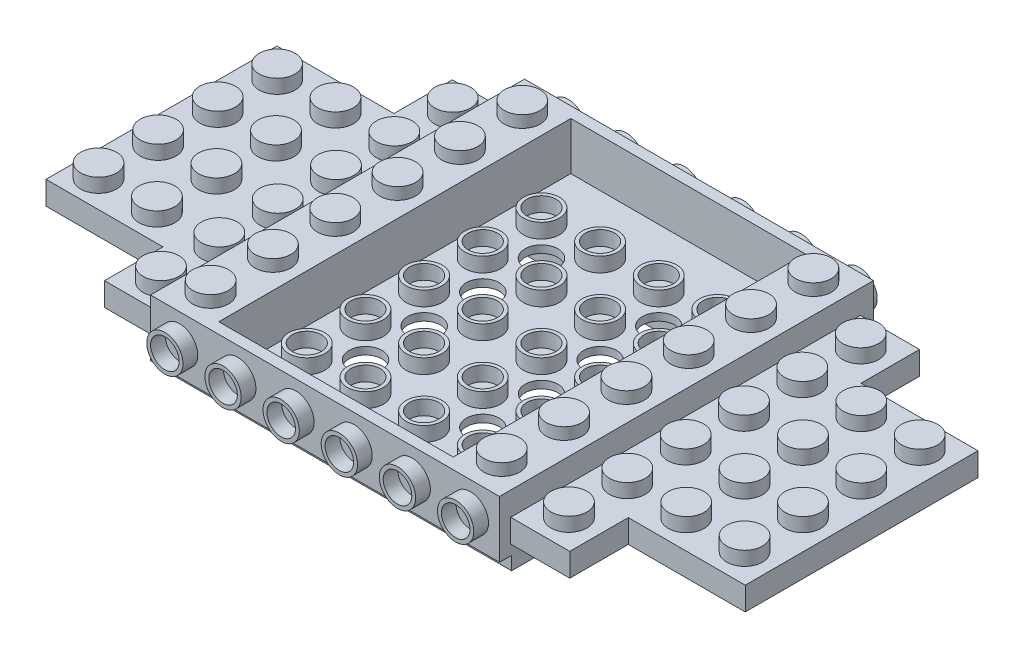
from build123d import *

# Parameters (mm, degrees)
SKETCH2_W            = 47.72
SKETCH2_H            = 51.14
BOSS_EXTRUDE1_DEPTH  = 9.64
SKETCH3_W            = 32.06
SKETCH3_H            = 48.14
CUT_EXTRUDE1_DEPTH   = 6.53
SKETCH4_W            = 47.83
SKETCH4_H            = 3.18
BOSS_EXTRUDE2_DEPTH  = 8.08
SKETCH5_W            = 1.66
SKETCH5_H            = 1.84
CUT_EXTRUDE2_DEPTH   = 55.990480085
SKETCH6_W            = 31.83
SKETCH6_H            = 3.18
BOSS_EXTRUDE3_DEPTH  = 16
SKETCH8_W            = 47.58
SKETCH8_H            = 3.18
BOSS_EXTRUDE4_DEPTH  = 8.08
SKETCH9_W            = 31.58
SKETCH9_H            = 3.18
BOSS_EXTRUDE5_DEPTH  = 16
SKETCH12_R           = 2.455
BOSS_EXTRUDE6_DEPTH  = 1.91
SKETCH13_R           = 2.455
BOSS_EXTRUDE7_DEPTH  = 1.91
SKETCH14_W           = 22.48
SKETCH14_H           = 28.38
CUT_EXTRUDE3_DEPTH   = 2.25
SKETCH17_W           = 6.48
SKETCH17_H           = 6.4
CUT_EXTRUDE7_DEPTH   = 2.25
SKETCH18_W           = 22.48
SKETCH18_H           = 28.63
SKETCH18_W_2         = 6.48
SKETCH18_H_2         = 6.4
CUT_EXTRUDE8_DEPTH   = 2.25
SKETCH20_R           = 0.855
CUT_EXTRUDE9_DEPTH   = 1.64
SKETCH21_R           = 0.855
CUT_EXTRUDE10_DEPTH  = 1.64
SKETCH22_R           = 2.48
SKETCH22_R_2         = 1.955
BOSS_EXTRUDE8_DEPTH  = 2.02
BOSS_EXTRUDE9_START  = 2.02
SKETCH23_R           = 2.48
SKETCH23_R_2         = 1.955
BOSS_EXTRUDE9_DEPTH  = 2.02
SKETCH24_R           = 2.455
BOSS_EXTRUDE10_DEPTH = 1.62
SKETCH25_W           = 45.2
SKETCH25_H           = 6.466900246
SKETCH25_W_2         = 5.18
SKETCH25_H_2         = 28.906199508
SKETCH25_W_3         = 5.24
SKETCH25_W_4         = 31.96
CUT_EXTRUDE11_DEPTH  = 2.09
SKETCH26_R           = 2.465
SKETCH26_R_2         = 1.995
BOSS_EXTRUDE11_DEPTH = 1.99
SKETCH27_R           = 2.25
CUT_EXTRUDE14_DEPTH  = 56.909517973
SKETCH28_W           = 5.18
SKETCH28_H           = 28.906199508
CUT_EXTRUDE15_DEPTH  = 6.2
SKETCH30_W           = 5.24
SKETCH30_H           = 28.906199508
CUT_EXTRUDE16_DEPTH  = 6.2
SKETCH31_W           = 5.24
SKETCH31_H           = 6.466900246
SKETCH31_W_2         = 5.18
CUT_EXTRUDE17_DEPTH  = 6.2
SKETCH32_W           = 5.24
SKETCH32_H           = 6.466900246
SKETCH32_W_2         = 5.18
CUT_EXTRUDE18_DEPTH  = 6.2
FILLET1_R            = 0.4
SKETCH34_R           = 1.485
SKETCH34_R_2         = 1.035
BOSS_EXTRUDE13_DEPTH = 2.3
SKETCH35_R           = 3.23
SKETCH35_R_2         = 2.43
BOSS_EXTRUDE15_DEPTH = 2.05


with BuildPart() as part:
    # Sketch2 → Boss-Extrude1 (new body)
    with BuildSketch(Plane(origin=(0, 0, 0), x_dir=(1, 0, 0), z_dir=(0, 1, 0))):
        Rectangle(SKETCH2_W, SKETCH2_H)
    extrude(amount=-BOSS_EXTRUDE1_DEPTH)

    # Sketch3 → Cut-Extrude1 (cut)
    with BuildSketch(Plane(origin=(0, 0, 0), x_dir=(1, 0, 0), z_dir=(0, 1, 0))):
        Rectangle(SKETCH3_W, SKETCH3_H)
    extrude(amount=-CUT_EXTRUDE1_DEPTH, mode=Mode.SUBTRACT)

    # Sketch4 → Boss-Extrude2 (add)
    with BuildSketch(Plane(origin=(23.86, 0, 0), x_dir=(0, 0, -1), z_dir=(1, 0, 0))):
        with Locations((-0.125, -4.82)):
            Rectangle(SKETCH4_W, SKETCH4_H)
    extrude(amount=BOSS_EXTRUDE2_DEPTH)

    # Sketch5 → Cut-Extrude2 (cut, through all)
    with BuildSketch(Plane(origin=(23.86, 0, 0), x_dir=(0, 0, -1), z_dir=(1, 0, 0))):
        with Locations((-24.74, -8.72)):
            Rectangle(SKETCH5_W, SKETCH5_H)
        with Locations((24.74, -8.72)):
            Rectangle(SKETCH5_W, SKETCH5_H)
    extrude(amount=-CUT_EXTRUDE2_DEPTH, mode=Mode.SUBTRACT)

    # Sketch6 → Boss-Extrude3 (add)
    with BuildSketch(Plane(origin=(31.94, 0, 0), x_dir=(0, 0, -1), z_dir=(1, 0, 0))):
        with Locations((-0.125, -4.82)):
            Rectangle(SKETCH6_W, SKETCH6_H)
    extrude(amount=BOSS_EXTRUDE3_DEPTH)

    # Sketch8 → Boss-Extrude4 (add)
    with BuildSketch(Plane.ZY.offset(23.86)):
        with Locations((0, -4.82)):
            Rectangle(SKETCH8_W, SKETCH8_H)
    extrude(amount=BOSS_EXTRUDE4_DEPTH)

    # Sketch9 → Boss-Extrude5 (add)
    with BuildSketch(Plane.ZY.offset(31.94)):
        with Locations((0, -4.82)):
            Rectangle(SKETCH9_W, SKETCH9_H)
    extrude(amount=BOSS_EXTRUDE5_DEPTH)

    # Sketch12 → Boss-Extrude6 (add)
    with BuildSketch(Plane(origin=(0, -3.23, 0), x_dir=(1, 0, 0), z_dir=(0, 1, 0))):
        with Locations(Location((-27.9, 19.79, 0), (0, 0, 90))):
            Circle(SKETCH12_R)
        with Locations(Location((-27.9, 11.811666667, 0), (0, 0, 90))):
            Circle(SKETCH12_R)
        with Locations(Location((-27.9, 3.833333333, 0), (0, 0, 90))):
            Circle(SKETCH12_R)
        with Locations(Location((-27.9, -4.145, 0), (0, 0, 90))):
            Circle(SKETCH12_R)
        with Locations(Location((-27.9, -12.123333333, 0), (0, 0, 90))):
            Circle(SKETCH12_R)
        with Locations(Location((-27.9, -20.101666667, 0), (0, 0, 90))):
            Circle(SKETCH12_R)
        with Locations(Location((-43.9275, 11.811666667, 0), (0, 0, 90))):
            Circle(SKETCH12_R)
        with Locations(Location((-35.9475, 11.811666667, 0), (0, 0, 90))):
            Circle(SKETCH12_R)
        with Locations(Location((-36.110586548, 3.833333333, 0), (0, 0, 90))):
            Circle(SKETCH12_R)
        with Locations(Location((-36.273673097, -4.145, 0), (0, 0, 90))):
            Circle(SKETCH12_R)
        with Locations(Location((-36.436759645, -12.123333333, 0), (0, 0, 90))):
            Circle(SKETCH12_R)
        with Locations(Location((-44.090586548, 3.833333333, 0), (0, 0, 90))):
            Circle(SKETCH12_R)
        with Locations(Location((-44.253673097, -4.145, 0), (0, 0, 90))):
            Circle(SKETCH12_R)
        with Locations(Location((-44.416759645, -12.123333333, 0), (0, 0, 90))):
            Circle(SKETCH12_R)
    extrude(amount=BOSS_EXTRUDE6_DEPTH)

    # Sketch13 → Boss-Extrude7 (add)
    with BuildSketch(Plane(origin=(0, -3.23, 0), x_dir=(1, 0, 0), z_dir=(0, 1, 0))):
        with Locations(Location((27.9, 19.79, 0), (0, 0, 90))):
            Circle(SKETCH13_R)
        with Locations(Location((27.9, 11.81, 0), (0, 0, 90))):
            Circle(SKETCH13_R)
        with Locations(Location((27.9, 3.83, 0), (0, 0, 90))):
            Circle(SKETCH13_R)
        with Locations(Location((27.9, -4.15, 0), (0, 0, 90))):
            Circle(SKETCH13_R)
        with Locations(Location((27.9, -12.13, 0), (0, 0, 90))):
            Circle(SKETCH13_R)
        with Locations(Location((27.9, -20.11, 0), (0, 0, 90))):
            Circle(SKETCH13_R)
        with Locations(Location((43.94, 11.81, 0), (0, 0, 90))):
            Circle(SKETCH13_R)
        with Locations(Location((35.96, 11.81, 0), (0, 0, 90))):
            Circle(SKETCH13_R)
        with Locations(Location((35.96, 3.83, 0), (0, 0, 90))):
            Circle(SKETCH13_R)
        with Locations(Location((35.96, -4.15, 0), (0, 0, 90))):
            Circle(SKETCH13_R)
        with Locations(Location((35.96, -12.13, 0), (0, 0, 90))):
            Circle(SKETCH13_R)
        with Locations(Location((43.94, 3.83, 0), (0, 0, 90))):
            Circle(SKETCH13_R)
        with Locations(Location((43.94, -4.15, 0), (0, 0, 90))):
            Circle(SKETCH13_R)
        with Locations(Location((43.94, -12.13, 0), (0, 0, 90))):
            Circle(SKETCH13_R)
    extrude(amount=BOSS_EXTRUDE7_DEPTH)

    # Sketch14 → Cut-Extrude3 (cut)
    with BuildSketch(Plane.XZ.offset(6.41)):
        with Locations((-35.1, 0)):
            Rectangle(SKETCH14_W, SKETCH14_H)
    extrude(amount=-CUT_EXTRUDE3_DEPTH, mode=Mode.SUBTRACT)

    # Sketch17 → Cut-Extrude7 (cut)
    with BuildSketch(Plane.XZ.offset(6.41)):
        with Locations((-27.1, 18.99)):
            Rectangle(SKETCH17_W, SKETCH17_H)
        with Locations((-27.1, -18.99)):
            Rectangle(SKETCH17_W, SKETCH17_H)
    extrude(amount=-CUT_EXTRUDE7_DEPTH, mode=Mode.SUBTRACT)

    # Sketch18 → Cut-Extrude8 (cut)
    with BuildSketch(Plane.XZ.offset(6.41)):
        with Locations((35.1, 0.125)):
            Rectangle(SKETCH18_W, SKETCH18_H)
        with Locations((27.1, 19.24)):
            Rectangle(SKETCH18_W_2, SKETCH18_H_2)
        with Locations((27.1, -19.24)):
            Rectangle(SKETCH18_W_2, SKETCH18_H_2)
    extrude(amount=-CUT_EXTRUDE8_DEPTH, mode=Mode.SUBTRACT)

    # Sketch20 → Cut-Extrude9 (cut)
    with BuildSketch(Plane.XZ.offset(4.16)):
        with Locations(Location((27.9, 20.04, 0), (0, 0, 270))):
            Circle(SKETCH20_R)
        with Locations(Location((27.9, 12.06, 0), (0, 0, 270))):
            Circle(SKETCH20_R)
        with Locations(Location((27.9, 4.08, 0), (0, 0, 270))):
            Circle(SKETCH20_R)
        with Locations(Location((27.9, -3.9, 0), (0, 0, 270))):
            Circle(SKETCH20_R)
        with Locations(Location((27.9, -11.88, 0), (0, 0, 270))):
            Circle(SKETCH20_R)
        with Locations(Location((27.9, -19.86, 0), (0, 0, 270))):
            Circle(SKETCH20_R)
        with Locations(Location((35.88, -11.88, 0), (0, 0, 270))):
            Circle(SKETCH20_R)
        with Locations(Location((35.88, -3.9, 0), (0, 0, 270))):
            Circle(SKETCH20_R)
        with Locations(Location((43.86, -11.88, 0), (0, 0, 270))):
            Circle(SKETCH20_R)
        with Locations(Location((43.86, -3.9, 0), (0, 0, 270))):
            Circle(SKETCH20_R)
        with Locations(Location((35.88, 4.08, 0), (0, 0, 270))):
            Circle(SKETCH20_R)
        with Locations(Location((35.88, 12.06, 0), (0, 0, 270))):
            Circle(SKETCH20_R)
        with Locations(Location((43.86, 4.08, 0), (0, 0, 270))):
            Circle(SKETCH20_R)
        with Locations(Location((43.86, 12.06, 0), (0, 0, 270))):
            Circle(SKETCH20_R)
    extrude(amount=-CUT_EXTRUDE9_DEPTH, mode=Mode.SUBTRACT)

    # Sketch21 → Cut-Extrude10 (cut)
    with BuildSketch(Plane.XZ.offset(4.16)):
        with Locations(Location((-27.9, -19.79, 0), (0, 0, 270))):
            Circle(SKETCH21_R)
        with Locations(Location((-27.9, -11.81, 0), (0, 0, 270))):
            Circle(SKETCH21_R)
        with Locations(Location((-27.9, -3.83, 0), (0, 0, 270))):
            Circle(SKETCH21_R)
        with Locations(Location((-27.9, 4.15, 0), (0, 0, 270))):
            Circle(SKETCH21_R)
        with Locations(Location((-27.9, 12.13, 0), (0, 0, 270))):
            Circle(SKETCH21_R)
        with Locations(Location((-27.9, 20.11, 0), (0, 0, 270))):
            Circle(SKETCH21_R)
        with Locations(Location((-43.9275, -11.811666667, 0), (0, 0, 270))):
            Circle(SKETCH21_R)
        with Locations(Location((-43.9275, -3.831666667, 0), (0, 0, 270))):
            Circle(SKETCH21_R)
        with Locations(Location((-43.9275, 4.148333333, 0), (0, 0, 270))):
            Circle(SKETCH21_R)
        with Locations(Location((-43.9275, 12.128333333, 0), (0, 0, 270))):
            Circle(SKETCH21_R)
        with Locations(Location((-35.9475, -3.831666667, 0), (0, 0, 270))):
            Circle(SKETCH21_R)
        with Locations(Location((-35.9475, 4.148333333, 0), (0, 0, 270))):
            Circle(SKETCH21_R)
        with Locations(Location((-35.9475, 12.128333333, 0), (0, 0, 270))):
            Circle(SKETCH21_R)
        with Locations(Location((-35.9475, -11.811666667, 0), (0, 0, 270))):
            Circle(SKETCH21_R)
    extrude(amount=-CUT_EXTRUDE10_DEPTH, mode=Mode.SUBTRACT)

    # Sketch22 → Boss-Extrude8 (add)
    # profile 1 of 6: a face of its own
    with BuildSketch(Plane(origin=(0, 0, -25.57), x_dir=(-1, 0, 0), z_dir=(0, 0, -1))):
        with Locations((-19.883333333, -3.9)):
            Circle(SKETCH22_R)
        with Locations((-19.883333333, -3.9)):
            Circle(SKETCH22_R_2, mode=Mode.SUBTRACT)
    # profile 2 of 6: a face of its own
    with BuildSketch(Plane(origin=(0, 0, -25.57), x_dir=(-1, 0, 0), z_dir=(0, 0, -1))):
        with Locations((-11.93, -3.9)):
            Circle(SKETCH22_R)
        with Locations((-11.93, -3.9)):
            Circle(SKETCH22_R_2, mode=Mode.SUBTRACT)
    # profile 3 of 6: a face of its own
    with BuildSketch(Plane(origin=(0, 0, -25.57), x_dir=(-1, 0, 0), z_dir=(0, 0, -1))):
        with Locations((-3.976666667, -3.9)):
            Circle(SKETCH22_R)
        with Locations((-3.976666667, -3.9)):
            Circle(SKETCH22_R_2, mode=Mode.SUBTRACT)
    # profile 4 of 6: a face of its own
    with BuildSketch(Plane(origin=(0, 0, -25.57), x_dir=(-1, 0, 0), z_dir=(0, 0, -1))):
        with Locations((3.976666667, -3.9)):
            Circle(SKETCH22_R)
        with Locations((3.976666667, -3.9)):
            Circle(SKETCH22_R_2, mode=Mode.SUBTRACT)
    # profile 5 of 6: a face of its own
    with BuildSketch(Plane(origin=(0, 0, -25.57), x_dir=(-1, 0, 0), z_dir=(0, 0, -1))):
        with Locations((11.93, -3.9)):
            Circle(SKETCH22_R)
        with Locations((11.93, -3.9)):
            Circle(SKETCH22_R_2, mode=Mode.SUBTRACT)
    # profile 6 of 6: a face of its own
    with BuildSketch(Plane(origin=(0, 0, -25.57), x_dir=(-1, 0, 0), z_dir=(0, 0, -1))):
        with Locations((19.883333333, -3.9)):
            Circle(SKETCH22_R)
        with Locations((19.883333333, -3.9)):
            Circle(SKETCH22_R_2, mode=Mode.SUBTRACT)
    extrude(amount=BOSS_EXTRUDE8_DEPTH)

    # Sketch23 → Boss-Extrude9 (add)
    # profile 1 of 6: a face of its own
    with BuildSketch(Plane.XY.offset(25.57).offset(BOSS_EXTRUDE9_START)):
        with Locations(Location((-19.883333333, -3.9, 0), (0, 0, 180))):
            Circle(SKETCH23_R)
        with Locations(Location((-19.883333333, -3.9, 0), (0, 0, 180))):
            Circle(SKETCH23_R_2, mode=Mode.SUBTRACT)
    # profile 2 of 6: a face of its own
    with BuildSketch(Plane.XY.offset(25.57).offset(BOSS_EXTRUDE9_START)):
        with Locations(Location((-11.93, -3.9, 0), (0, 0, 180))):
            Circle(SKETCH23_R)
        with Locations(Location((-11.93, -3.9, 0), (0, 0, 180))):
            Circle(SKETCH23_R_2, mode=Mode.SUBTRACT)
    # profile 3 of 6: a face of its own
    with BuildSketch(Plane.XY.offset(25.57).offset(BOSS_EXTRUDE9_START)):
        with Locations(Location((-3.976666667, -3.9, 0), (0, 0, 180))):
            Circle(SKETCH23_R)
        with Locations(Location((-3.976666667, -3.9, 0), (0, 0, 180))):
            Circle(SKETCH23_R_2, mode=Mode.SUBTRACT)
    # profile 4 of 6: a face of its own
    with BuildSketch(Plane.XY.offset(25.57).offset(BOSS_EXTRUDE9_START)):
        with Locations(Location((3.976666667, -3.9, 0), (0, 0, 180))):
            Circle(SKETCH23_R)
        with Locations(Location((3.976666667, -3.9, 0), (0, 0, 180))):
            Circle(SKETCH23_R_2, mode=Mode.SUBTRACT)
    # profile 5 of 6: a face of its own
    with BuildSketch(Plane.XY.offset(25.57).offset(BOSS_EXTRUDE9_START)):
        with Locations(Location((11.93, -3.9, 0), (0, 0, 180))):
            Circle(SKETCH23_R)
        with Locations(Location((11.93, -3.9, 0), (0, 0, 180))):
            Circle(SKETCH23_R_2, mode=Mode.SUBTRACT)
    # profile 6 of 6: a face of its own
    with BuildSketch(Plane.XY.offset(25.57).offset(BOSS_EXTRUDE9_START)):
        with Locations(Location((19.883333333, -3.9, 0), (0, 0, 180))):
            Circle(SKETCH23_R)
        with Locations(Location((19.883333333, -3.9, 0), (0, 0, 180))):
            Circle(SKETCH23_R_2, mode=Mode.SUBTRACT)
    extrude(amount=-BOSS_EXTRUDE9_DEPTH)

    # Sketch24 → Boss-Extrude10 (add)
    with BuildSketch(Plane(origin=(0, 0, 0), x_dir=(1, 0, 0), z_dir=(0, 1, 0))):
        with Locations(Location((-19.91, 21.308333333, 0), (0, 0, 270))):
            Circle(SKETCH24_R)
        with Locations(Location((-19.91, 12.785, 0), (0, 0, 270))):
            Circle(SKETCH24_R)
        with Locations(Location((-19.91, 4.261666667, 0), (0, 0, 270))):
            Circle(SKETCH24_R)
        with Locations(Location((-19.91, -4.261666667, 0), (0, 0, 270))):
            Circle(SKETCH24_R)
        with Locations(Location((-19.91, -12.785, 0), (0, 0, 270))):
            Circle(SKETCH24_R)
        with Locations(Location((-19.91, -21.308333333, 0), (0, 0, 270))):
            Circle(SKETCH24_R)
        with Locations(Location((19.91, -21.308333333, 0), (0, 0, 90))):
            Circle(SKETCH24_R)
        with Locations(Location((19.91, -12.785, 0), (0, 0, 90))):
            Circle(SKETCH24_R)
        with Locations(Location((19.91, -4.261666667, 0), (0, 0, 90))):
            Circle(SKETCH24_R)
        with Locations(Location((19.91, 4.261666667, 0), (0, 0, 90))):
            Circle(SKETCH24_R)
        with Locations(Location((19.91, 12.785, 0), (0, 0, 90))):
            Circle(SKETCH24_R)
        with Locations(Location((19.91, 21.308333333, 0), (0, 0, 90))):
            Circle(SKETCH24_R)
    extrude(amount=BOSS_EXTRUDE10_DEPTH)

    # Sketch25 → Cut-Extrude11 (cut)
    with BuildSketch(Plane.XZ.offset(9.64)):
        with Locations((0, 19.126549877)):
            Rectangle(SKETCH25_W, SKETCH25_H)
        with Locations((20.01, 0)):
            Rectangle(SKETCH25_W_2, SKETCH25_H_2)
        with Locations((-19.98, 0)):
            Rectangle(SKETCH25_W_3, SKETCH25_H_2)
        with Locations((0, -19.126549877)):
            Rectangle(SKETCH25_W, SKETCH25_H)
        Rectangle(SKETCH25_W_4, SKETCH25_H_2)
    extrude(amount=-CUT_EXTRUDE11_DEPTH, mode=Mode.SUBTRACT)

    # Sketch26 → Boss-Extrude11 (add)
    # profile 1 of 20: a face of its own
    with BuildSketch(Plane(origin=(0, -6.53, 0), x_dir=(1, 0, 0), z_dir=(0, 1, 0))):
        with Locations(Location((-12.0225, 16.046666667, 0), (0, 0, 270))):
            Circle(SKETCH26_R)
        with Locations(Location((-12.0225, 16.046666667, 0), (0, 0, 270))):
            Circle(SKETCH26_R_2, mode=Mode.SUBTRACT)
    # profile 2 of 20: a face of its own
    with BuildSketch(Plane(origin=(0, -6.53, 0), x_dir=(1, 0, 0), z_dir=(0, 1, 0))):
        with Locations(Location((-3.999166667, 16.046666667, 0), (0, 0, 270))):
            Circle(SKETCH26_R)
        with Locations(Location((-3.999166667, 16.046666667, 0), (0, 0, 270))):
            Circle(SKETCH26_R_2, mode=Mode.SUBTRACT)
    # profile 3 of 20: a face of its own
    with BuildSketch(Plane(origin=(0, -6.53, 0), x_dir=(1, 0, 0), z_dir=(0, 1, 0))):
        with Locations(Location((4.024166667, 16.046666667, 0), (0, 0, 270))):
            Circle(SKETCH26_R)
        with Locations(Location((4.024166667, 16.046666667, 0), (0, 0, 270))):
            Circle(SKETCH26_R_2, mode=Mode.SUBTRACT)
    # profile 4 of 20: a face of its own
    with BuildSketch(Plane(origin=(0, -6.53, 0), x_dir=(1, 0, 0), z_dir=(0, 1, 0))):
        with Locations(Location((12.0475, 16.046666667, 0), (0, 0, 270))):
            Circle(SKETCH26_R)
        with Locations(Location((12.0475, 16.046666667, 0), (0, 0, 270))):
            Circle(SKETCH26_R_2, mode=Mode.SUBTRACT)
    # profile 5 of 20: a face of its own
    with BuildSketch(Plane(origin=(0, -6.53, 0), x_dir=(1, 0, 0), z_dir=(0, 1, 0))):
        with Locations(Location((-3.999166667, 8.023333333, 0), (0, 0, 270))):
            Circle(SKETCH26_R)
        with Locations(Location((-3.999166667, 8.023333333, 0), (0, 0, 270))):
            Circle(SKETCH26_R_2, mode=Mode.SUBTRACT)
    # profile 6 of 20: a face of its own
    with BuildSketch(Plane(origin=(0, -6.53, 0), x_dir=(1, 0, 0), z_dir=(0, 1, 0))):
        with Locations(Location((4.024166667, 8.023333333, 0), (0, 0, 270))):
            Circle(SKETCH26_R)
        with Locations(Location((4.024166667, 8.023333333, 0), (0, 0, 270))):
            Circle(SKETCH26_R_2, mode=Mode.SUBTRACT)
    # profile 7 of 20: a face of its own
    with BuildSketch(Plane(origin=(0, -6.53, 0), x_dir=(1, 0, 0), z_dir=(0, 1, 0))):
        with Locations(Location((12.0475, 8.023333333, 0), (0, 0, 270))):
            Circle(SKETCH26_R)
        with Locations(Location((12.0475, 8.023333333, 0), (0, 0, 270))):
            Circle(SKETCH26_R_2, mode=Mode.SUBTRACT)
    # profile 8 of 20: a face of its own
    with BuildSketch(Plane(origin=(0, -6.53, 0), x_dir=(1, 0, 0), z_dir=(0, 1, 0))):
        with Locations(Location((-3.999166667, 0, 0), (0, 0, 270))):
            Circle(SKETCH26_R)
        with Locations(Location((-3.999166667, 0, 0), (0, 0, 270))):
            Circle(SKETCH26_R_2, mode=Mode.SUBTRACT)
    # profile 9 of 20: a face of its own
    with BuildSketch(Plane(origin=(0, -6.53, 0), x_dir=(1, 0, 0), z_dir=(0, 1, 0))):
        with Locations(Location((4.024166667, 0, 0), (0, 0, 270))):
            Circle(SKETCH26_R)
        with Locations(Location((4.024166667, 0, 0), (0, 0, 270))):
            Circle(SKETCH26_R_2, mode=Mode.SUBTRACT)
    # profile 10 of 20: a face of its own
    with BuildSketch(Plane(origin=(0, -6.53, 0), x_dir=(1, 0, 0), z_dir=(0, 1, 0))):
        with Locations(Location((12.0475, 0, 0), (0, 0, 270))):
            Circle(SKETCH26_R)
        with Locations(Location((12.0475, 0, 0), (0, 0, 270))):
            Circle(SKETCH26_R_2, mode=Mode.SUBTRACT)
    # profile 11 of 20: a face of its own
    with BuildSketch(Plane(origin=(0, -6.53, 0), x_dir=(1, 0, 0), z_dir=(0, 1, 0))):
        with Locations(Location((-3.999166667, -8.023333333, 0), (0, 0, 270))):
            Circle(SKETCH26_R)
        with Locations(Location((-3.999166667, -8.023333333, 0), (0, 0, 270))):
            Circle(SKETCH26_R_2, mode=Mode.SUBTRACT)
    # profile 12 of 20: a face of its own
    with BuildSketch(Plane(origin=(0, -6.53, 0), x_dir=(1, 0, 0), z_dir=(0, 1, 0))):
        with Locations(Location((4.024166667, -8.023333333, 0), (0, 0, 270))):
            Circle(SKETCH26_R)
        with Locations(Location((4.024166667, -8.023333333, 0), (0, 0, 270))):
            Circle(SKETCH26_R_2, mode=Mode.SUBTRACT)
    # profile 13 of 20: a face of its own
    with BuildSketch(Plane(origin=(0, -6.53, 0), x_dir=(1, 0, 0), z_dir=(0, 1, 0))):
        with Locations(Location((12.0475, -8.023333333, 0), (0, 0, 270))):
            Circle(SKETCH26_R)
        with Locations(Location((12.0475, -8.023333333, 0), (0, 0, 270))):
            Circle(SKETCH26_R_2, mode=Mode.SUBTRACT)
    # profile 14 of 20: a face of its own
    with BuildSketch(Plane(origin=(0, -6.53, 0), x_dir=(1, 0, 0), z_dir=(0, 1, 0))):
        with Locations(Location((-3.999166667, -16.046666667, 0), (0, 0, 270))):
            Circle(SKETCH26_R)
        with Locations(Location((-3.999166667, -16.046666667, 0), (0, 0, 270))):
            Circle(SKETCH26_R_2, mode=Mode.SUBTRACT)
    # profile 15 of 20: a face of its own
    with BuildSketch(Plane(origin=(0, -6.53, 0), x_dir=(1, 0, 0), z_dir=(0, 1, 0))):
        with Locations(Location((4.024166667, -16.046666667, 0), (0, 0, 270))):
            Circle(SKETCH26_R)
        with Locations(Location((4.024166667, -16.046666667, 0), (0, 0, 270))):
            Circle(SKETCH26_R_2, mode=Mode.SUBTRACT)
    # profile 16 of 20: a face of its own
    with BuildSketch(Plane(origin=(0, -6.53, 0), x_dir=(1, 0, 0), z_dir=(0, 1, 0))):
        with Locations(Location((12.0475, -16.046666667, 0), (0, 0, 270))):
            Circle(SKETCH26_R)
        with Locations(Location((12.0475, -16.046666667, 0), (0, 0, 270))):
            Circle(SKETCH26_R_2, mode=Mode.SUBTRACT)
    # profile 17 of 20: a face of its own
    with BuildSketch(Plane(origin=(0, -6.53, 0), x_dir=(1, 0, 0), z_dir=(0, 1, 0))):
        with Locations(Location((-12.0225, 8.023333333, 0), (0, 0, 270))):
            Circle(SKETCH26_R)
        with Locations(Location((-12.0225, 8.023333333, 0), (0, 0, 270))):
            Circle(SKETCH26_R_2, mode=Mode.SUBTRACT)
    # profile 18 of 20: a face of its own
    with BuildSketch(Plane(origin=(0, -6.53, 0), x_dir=(1, 0, 0), z_dir=(0, 1, 0))):
        with Locations(Location((-12.0225, 0, 0), (0, 0, 270))):
            Circle(SKETCH26_R)
        with Locations(Location((-12.0225, 0, 0), (0, 0, 270))):
            Circle(SKETCH26_R_2, mode=Mode.SUBTRACT)
    # profile 19 of 20: a face of its own
    with BuildSketch(Plane(origin=(0, -6.53, 0), x_dir=(1, 0, 0), z_dir=(0, 1, 0))):
        with Locations(Location((-12.0225, -8.023333333, 0), (0, 0, 270))):
            Circle(SKETCH26_R)
        with Locations(Location((-12.0225, -8.023333333, 0), (0, 0, 270))):
            Circle(SKETCH26_R_2, mode=Mode.SUBTRACT)
    # profile 20 of 20: a face of its own
    with BuildSketch(Plane(origin=(0, -6.53, 0), x_dir=(1, 0, 0), z_dir=(0, 1, 0))):
        with Locations(Location((-12.0225, -16.046666667, 0), (0, 0, 270))):
            Circle(SKETCH26_R)
        with Locations(Location((-12.0225, -16.046666667, 0), (0, 0, 270))):
            Circle(SKETCH26_R_2, mode=Mode.SUBTRACT)
    extrude(amount=BOSS_EXTRUDE11_DEPTH)

    # Sketch27 → Cut-Extrude14 (cut, through all)
    with BuildSketch(Plane(origin=(0, -6.53, 0), x_dir=(1, 0, 0), z_dir=(0, 1, 0))):
        with Locations(Location((-8.009166667, 12.036666667, 0), (0, 0, 270))):
            Circle(SKETCH27_R)
        with Locations(Location((-8.009166667, 4.016666667, 0), (0, 0, 270))):
            Circle(SKETCH27_R)
        with Locations(Location((-8.009166667, -4.003333333, 0), (0, 0, 270))):
            Circle(SKETCH27_R)
        with Locations(Location((-8.009166667, -12.023333333, 0), (0, 0, 270))):
            Circle(SKETCH27_R)
        with Locations(Location((8.0375, 12.036666667, 0), (0, 0, 270))):
            Circle(SKETCH27_R)
        with Locations(Location((8.0375, 4.016666667, 0), (0, 0, 270))):
            Circle(SKETCH27_R)
        with Locations(Location((8.0375, -4.003333333, 0), (0, 0, 270))):
            Circle(SKETCH27_R)
        with Locations(Location((8.0375, -12.023333333, 0), (0, 0, 270))):
            Circle(SKETCH27_R)
    extrude(amount=-CUT_EXTRUDE14_DEPTH, mode=Mode.SUBTRACT)

    # Sketch28 → Cut-Extrude15 (cut)
    with BuildSketch(Plane.XZ.offset(7.55)):
        with Locations((20.01, 0)):
            Rectangle(SKETCH28_W, SKETCH28_H)
    extrude(amount=-CUT_EXTRUDE15_DEPTH, mode=Mode.SUBTRACT)

    # Sketch30 → Cut-Extrude16 (cut)
    with BuildSketch(Plane.XZ.offset(7.55)):
        with Locations((-19.98, 0)):
            Rectangle(SKETCH30_W, SKETCH30_H)
    extrude(amount=-CUT_EXTRUDE16_DEPTH, mode=Mode.SUBTRACT)

    # Sketch31 → Cut-Extrude17 (cut)
    with BuildSketch(Plane.XZ.offset(7.55)):
        with Locations((-19.98, 19.126549877)):
            Rectangle(SKETCH31_W, SKETCH31_H)
        with Locations((20.01, 19.126549877)):
            Rectangle(SKETCH31_W_2, SKETCH31_H)
    extrude(amount=-CUT_EXTRUDE17_DEPTH, mode=Mode.SUBTRACT)

    # Sketch32 → Cut-Extrude18 (cut)
    with BuildSketch(Plane.XZ.offset(7.55)):
        with Locations((-19.98, -19.126549877)):
            Rectangle(SKETCH32_W, SKETCH32_H)
        with Locations((20.01, -19.126549877)):
            Rectangle(SKETCH32_W_2, SKETCH32_H)
    extrude(amount=-CUT_EXTRUDE18_DEPTH, mode=Mode.SUBTRACT)

    # Fillet1
    fillet1_edges = [part.edges().sort_by_distance(p)[0] for p in [
        (-17.36, -7.55, 19.126549877),
        (17.42, -7.55, 19.126549877),
        (-17.36, -7.55, -19.126549877),
        (17.42, -7.55, -19.126549877),
    ]]
    fillet(fillet1_edges, radius=FILLET1_R)

    # Sketch34 → Boss-Extrude13 (add)
    # profile 1 of 4: a face of its own
    with BuildSketch(Plane(origin=(0, -9.45, 0), x_dir=(1, 0, 0), z_dir=(0, 1, 0))):
        with Locations(Location((-15.906666667, -19.125, 0), (0, 0, 135.179239703))):
            Circle(SKETCH34_R)
        with Locations(Location((-15.906666667, -19.125, 0), (0, 0, 90))):
            Circle(SKETCH34_R_2, mode=Mode.SUBTRACT)
    # profile 2 of 4: a face of its own
    with BuildSketch(Plane(origin=(0, -9.45, 0), x_dir=(1, 0, 0), z_dir=(0, 1, 0))):
        with Locations(Location((15.906666667, -19.125, 0), (0, 0, 90))):
            Circle(SKETCH34_R)
        with Locations(Location((15.906666667, -19.125, 0), (0, 0, 90))):
            Circle(SKETCH34_R_2, mode=Mode.SUBTRACT)
    # profile 3 of 4: a face of its own
    with BuildSketch(Plane(origin=(0, -9.45, 0), x_dir=(1, 0, 0), z_dir=(0, 1, 0))):
        with Locations(Location((15.906666667, 19.125, 0), (0, 0, 41.433921283))):
            Circle(SKETCH34_R)
        with Locations(Location((15.906666667, 19.125, 0), (0, 0, 90))):
            Circle(SKETCH34_R_2, mode=Mode.SUBTRACT)
    # profile 4 of 4: a face of its own
    with BuildSketch(Plane(origin=(0, -9.45, 0), x_dir=(1, 0, 0), z_dir=(0, 1, 0))):
        with Locations(Location((-15.906666667, 19.125, 0), (0, 0, 90))):
            Circle(SKETCH34_R)
        with Locations(Location((-15.906666667, 19.125, 0), (0, 0, 90))):
            Circle(SKETCH34_R_2, mode=Mode.SUBTRACT)
    extrude(amount=BOSS_EXTRUDE13_DEPTH)

    # Sketch35 → Boss-Extrude15 (add)
    # profile 1 of 18: a face of its own
    with BuildSketch(Plane.XZ.offset(4.16)):
        with Locations(Location((-39.9375, 0.158333333, 0), (0, 0, 90))):
            Circle(SKETCH35_R)
        with Locations(Location((-39.9375, 0.158333333, 0), (0, 0, 90))):
            Circle(SKETCH35_R_2, mode=Mode.SUBTRACT)
    # profile 2 of 18: a face of its own
    with BuildSketch(Plane.XZ.offset(4.16)):
        with Locations(Location((-31.9575, 0.158333333, 0), (0, 0, 90))):
            Circle(SKETCH35_R)
        with Locations(Location((-31.9575, 0.158333333, 0), (0, 0, 90))):
            Circle(SKETCH35_R_2, mode=Mode.SUBTRACT)
    # profile 3 of 18: a face of its own
    with BuildSketch(Plane.XZ.offset(4.16)):
        with Locations(Location((-39.9375, -7.821666667, 0), (0, 0, 90))):
            Circle(SKETCH35_R)
        with Locations(Location((-39.9375, -7.821666667, 0), (0, 0, 90))):
            Circle(SKETCH35_R_2, mode=Mode.SUBTRACT)
    # profile 4 of 18: a face of its own
    with BuildSketch(Plane.XZ.offset(4.16)):
        with Locations(Location((-31.9575, -7.821666667, 0), (0, 0, 90))):
            Circle(SKETCH35_R)
        with Locations(Location((-31.9575, -7.821666667, 0), (0, 0, 90))):
            Circle(SKETCH35_R_2, mode=Mode.SUBTRACT)
    # profile 5 of 18: a face of its own
    with BuildSketch(Plane.XZ.offset(4.16)):
        with Locations(Location((-31.9575, 8.138333333, 0), (0, 0, 90))):
            Circle(SKETCH35_R)
        with Locations(Location((-31.9575, 8.138333333, 0), (0, 0, 90))):
            Circle(SKETCH35_R_2, mode=Mode.SUBTRACT)
    # profile 6 of 18: a face of its own
    with BuildSketch(Plane.XZ.offset(4.16)):
        with Locations(Location((-39.9375, 8.138333333, 0), (0, 0, 90))):
            Circle(SKETCH35_R)
        with Locations(Location((-39.9375, 8.138333333, 0), (0, 0, 90))):
            Circle(SKETCH35_R_2, mode=Mode.SUBTRACT)
    # profile 7 of 18: a face of its own
    with BuildSketch(Plane.XZ.offset(4.16)):
        with Locations(Location((39.9375, 8.138333333, 0), (0, 0, 90))):
            Circle(SKETCH35_R)
        with Locations(Location((39.9375, 8.138333333, 0), (0, 0, 90))):
            Circle(SKETCH35_R_2, mode=Mode.SUBTRACT)
    # profile 8 of 18: a face of its own
    with BuildSketch(Plane.XZ.offset(4.16)):
        with Locations(Location((31.9575, 8.138333333, 0), (0, 0, 90))):
            Circle(SKETCH35_R)
        with Locations(Location((31.9575, 8.138333333, 0), (0, 0, 90))):
            Circle(SKETCH35_R_2, mode=Mode.SUBTRACT)
    # profile 9 of 18: a face of its own
    with BuildSketch(Plane.XZ.offset(4.16)):
        with Locations(Location((31.9575, -7.821666667, 0), (0, 0, 90))):
            Circle(SKETCH35_R)
        with Locations(Location((31.9575, -7.821666667, 0), (0, 0, 90))):
            Circle(SKETCH35_R_2, mode=Mode.SUBTRACT)
    # profile 10 of 18: a face of its own
    with BuildSketch(Plane.XZ.offset(4.16)):
        with Locations(Location((39.9375, -7.821666667, 0), (0, 0, 90))):
            Circle(SKETCH35_R)
        with Locations(Location((39.9375, -7.821666667, 0), (0, 0, 90))):
            Circle(SKETCH35_R_2, mode=Mode.SUBTRACT)
    # profile 11 of 18: a face of its own
    with BuildSketch(Plane.XZ.offset(4.16)):
        with Locations(Location((31.9575, 0.158333333, 0), (0, 0, 90))):
            Circle(SKETCH35_R)
        with Locations(Location((31.9575, 0.158333333, 0), (0, 0, 90))):
            Circle(SKETCH35_R_2, mode=Mode.SUBTRACT)
    # profile 12 of 18: a face of its own
    with BuildSketch(Plane.XZ.offset(4.16)):
        with Locations(Location((39.9375, 0.158333333, 0), (0, 0, 90))):
            Circle(SKETCH35_R)
        with Locations(Location((39.9375, 0.158333333, 0), (0, 0, 90))):
            Circle(SKETCH35_R_2, mode=Mode.SUBTRACT)
    # profile 13 of 18: a face of its own
    with BuildSketch(Plane.XZ.offset(4.16)):
        with BuildLine():
            Line((-23.86, 11.368333333), (-23.86, 10.568333333))
            ThreePointArc((-23.86, 10.568333333), (-26.29, 8.138333333), (-23.86, 5.708333333))
            Line((-23.86, 5.708333333), (-23.86, 4.908333333))
            ThreePointArc((-23.86, 4.908333333), (-27.09, 8.138333333), (-23.86, 11.368333333))
        make_face()
    # profile 14 of 18: a face of its own
    with BuildSketch(Plane.XZ.offset(4.16)):
        with BuildLine():
            Line((-23.86, -3.071666667), (-23.86, -2.271666667))
            ThreePointArc((-23.86, -2.271666667), (-26.29, 0.158333333), (-23.86, 2.588333333))
            Line((-23.86, 2.588333333), (-23.86, 3.388333333))
            ThreePointArc((-23.86, 3.388333333), (-27.09, 0.158333333), (-23.86, -3.071666667))
        make_face()
    # profile 15 of 18: a face of its own
    with BuildSketch(Plane.XZ.offset(4.16)):
        with BuildLine():
            Line((-23.86, -10.251666667), (-23.86, -11.051666667))
            ThreePointArc((-23.86, -11.051666667), (-27.09, -7.821666667), (-23.86, -4.591666667))
            Line((-23.86, -4.591666667), (-23.86, -5.391666667))
            ThreePointArc((-23.86, -5.391666667), (-26.29, -7.821666667), (-23.86, -10.251666667))
        make_face()
    # profile 16 of 18: a face of its own
    with BuildSketch(Plane.XZ.offset(4.16)):
        with BuildLine():
            Line((23.86, -4.591666667), (23.86, -5.391666667))
            ThreePointArc((23.86, -5.391666667), (26.29, -7.821666667), (23.86, -10.251666667))
            Line((23.86, -10.251666667), (23.86, -11.051666667))
            ThreePointArc((23.86, -11.051666667), (27.09, -7.821666667), (23.86, -4.591666667))
        make_face()
    # profile 17 of 18: a face of its own
    with BuildSketch(Plane.XZ.offset(4.16)):
        with BuildLine():
            Line((23.86, 2.588333333), (23.86, 3.388333333))
            ThreePointArc((23.86, 3.388333333), (27.09, 0.158333333), (23.86, -3.071666667))
            Line((23.86, -3.071666667), (23.86, -2.271666667))
            ThreePointArc((23.86, -2.271666667), (26.29, 0.158333333), (23.86, 2.588333333))
        make_face()
    # profile 18 of 18: a face of its own
    with BuildSketch(Plane.XZ.offset(4.16)):
        with BuildLine():
            Line((23.86, 5.708333333), (23.86, 4.908333333))
            ThreePointArc((23.86, 4.908333333), (27.09, 8.138333333), (23.86, 11.368333333))
            Line((23.86, 11.368333333), (23.86, 10.568333333))
            ThreePointArc((23.86, 10.568333333), (26.29, 8.138333333), (23.86, 5.708333333))
        make_face()
    extrude(amount=BOSS_EXTRUDE15_DEPTH)


solid = part.part
